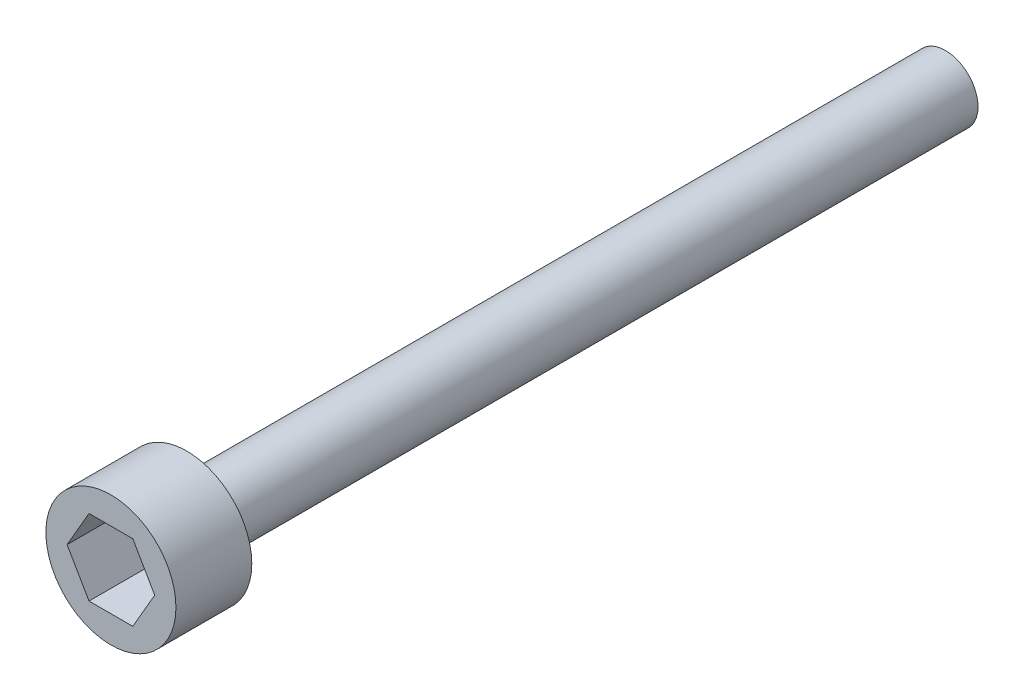
from build123d import *

# Parameters (mm, degrees)
SKETCH1_R                   = 3
HEAD_BOSS_EXTRUDE1_DEPTH    = 3.5
HEAD_HEX_CUT_EXTRUDE1_DEPTH = 2.8
SKETCH2_R                   = 1.5
SCREW_BOSS_EXTRUDE2_DEPTH   = 35


with BuildPart() as part:
    # Sketch1 → Head Boss-Extrude1 (new body)
    with BuildSketch(Plane.XY):
        Circle(SKETCH1_R)
    extrude(amount=HEAD_BOSS_EXTRUDE1_DEPTH)

    # Sketch3 → Head Hex Cut-Extrude1 (cut)
    with BuildSketch(Plane.XY.offset(3.5)):
        Polygon((-1.010362971, 1.75), (1.010362971, 1.75), (2.020725942, 0), (1.010362971, -1.75), (-1.010362971, -1.75), (-2.020725942, 0), align=None)
    extrude(amount=-HEAD_HEX_CUT_EXTRUDE1_DEPTH, mode=Mode.SUBTRACT)

    # Sketch2 → Screw Boss-Extrude2 (add)
    with BuildSketch(Plane.XY):
        Circle(SKETCH2_R)
    extrude(amount=-SCREW_BOSS_EXTRUDE2_DEPTH)


solid = part.part
